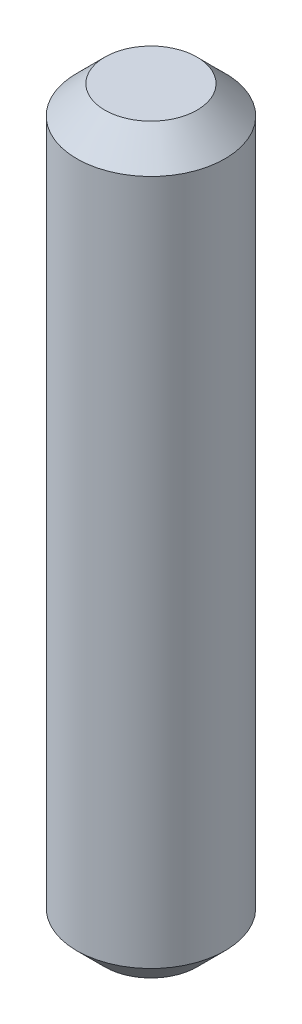
from build123d import *

# Parameters (mm, degrees)
SKETCH1_R           = 1.585
BOSS_EXTRUDE1_DEPTH = 7.935
CHAMFER1_SIZE       = 0.6


with BuildPart() as part:
    # Sketch1 → Boss-Extrude1 (new, symmetric)
    with BuildSketch(Plane(origin=(0, 0, 0), x_dir=(1, 0, 0), z_dir=(0, 1, 0))):
        with Locations(Location((0, 0, 0), (0, 0, 270))):
            Circle(SKETCH1_R)
    extrude(amount=BOSS_EXTRUDE1_DEPTH, both=True)

    # Chamfer1
    chamfer1_edges = [part.edges().sort_by_distance(p)[0] for p in [
        (0, 7.935, -1.585),
        (0, -7.935, -1.585),
    ]]
    chamfer(chamfer1_edges, length=CHAMFER1_SIZE)


solid = part.part
